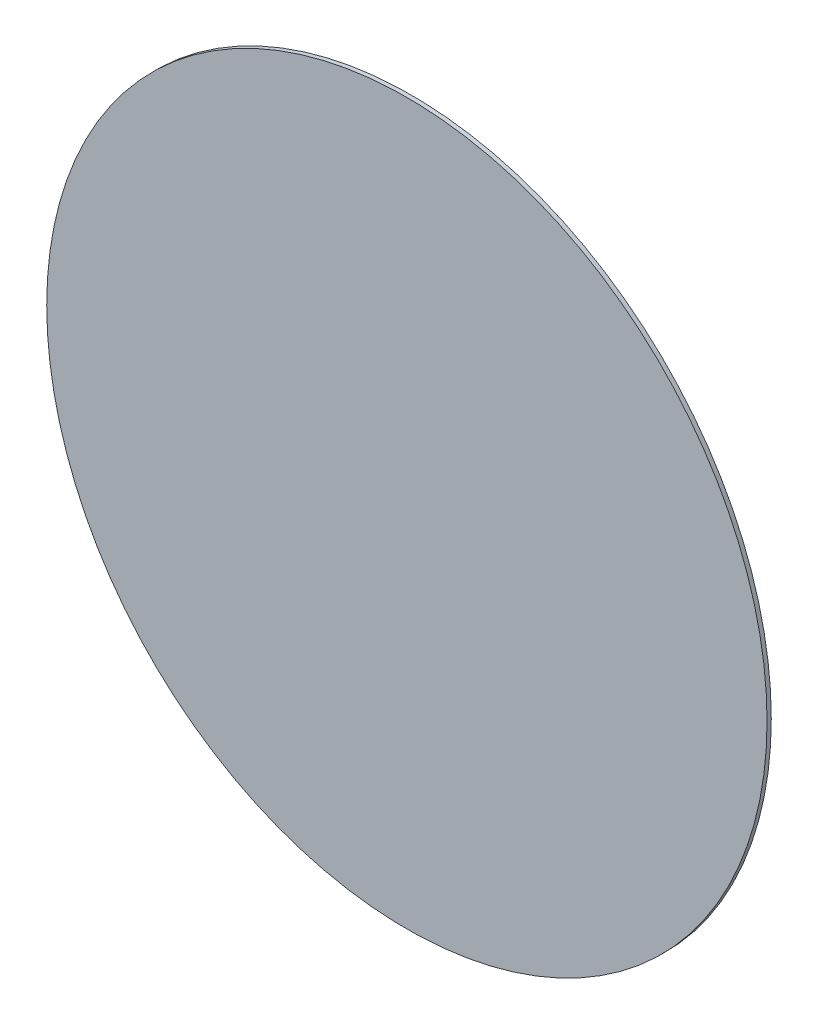
from build123d import *

# Parameters (mm, degrees)
SKETCH1_R  = 256
SKIN_DEPTH = 3


with BuildPart() as part:
    # Sketch1 → Skin (new body)
    with BuildSketch(Plane.XY):
        Circle(SKETCH1_R)
    extrude(amount=SKIN_DEPTH)


solid = part.part
